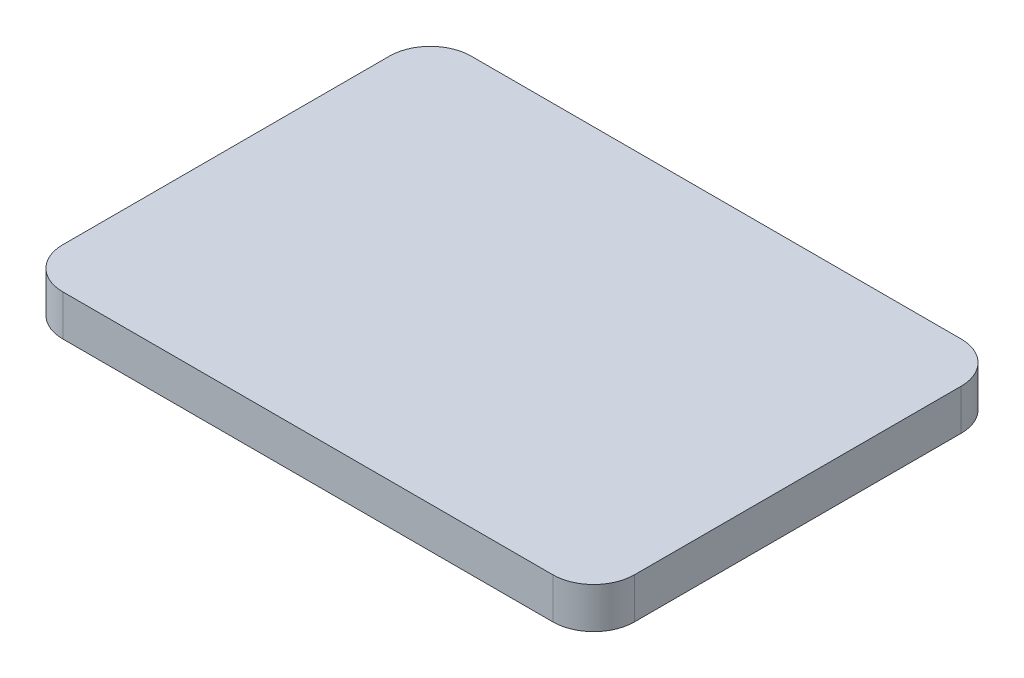
from build123d import *

# Parameters (mm, degrees)
BOSS_EXTRUDE1_DEPTH = 5


with BuildPart() as part:
    # Sketch1 → Boss-Extrude1 (new body)
    with BuildSketch(Plane(origin=(0, 0, 0), x_dir=(1, 0, 0), z_dir=(0, 1, 0))):
        with BuildLine():
            Line((5, 0), (65, 0))
            ThreePointArc((65, 0), (68.535533906, 1.464466094), (70, 5))
            Line((70, 5), (70, 45))
            ThreePointArc((70, 45), (68.535533906, 48.535533906), (65, 50))
            Line((65, 50), (5, 50))
            ThreePointArc((5, 50), (1.464466094, 48.535533906), (0, 45))
            Line((0, 45), (0, 5))
            ThreePointArc((0, 5), (1.464466094, 1.464466094), (5, 0))
        make_face()
    extrude(amount=BOSS_EXTRUDE1_DEPTH)


solid = part.part
